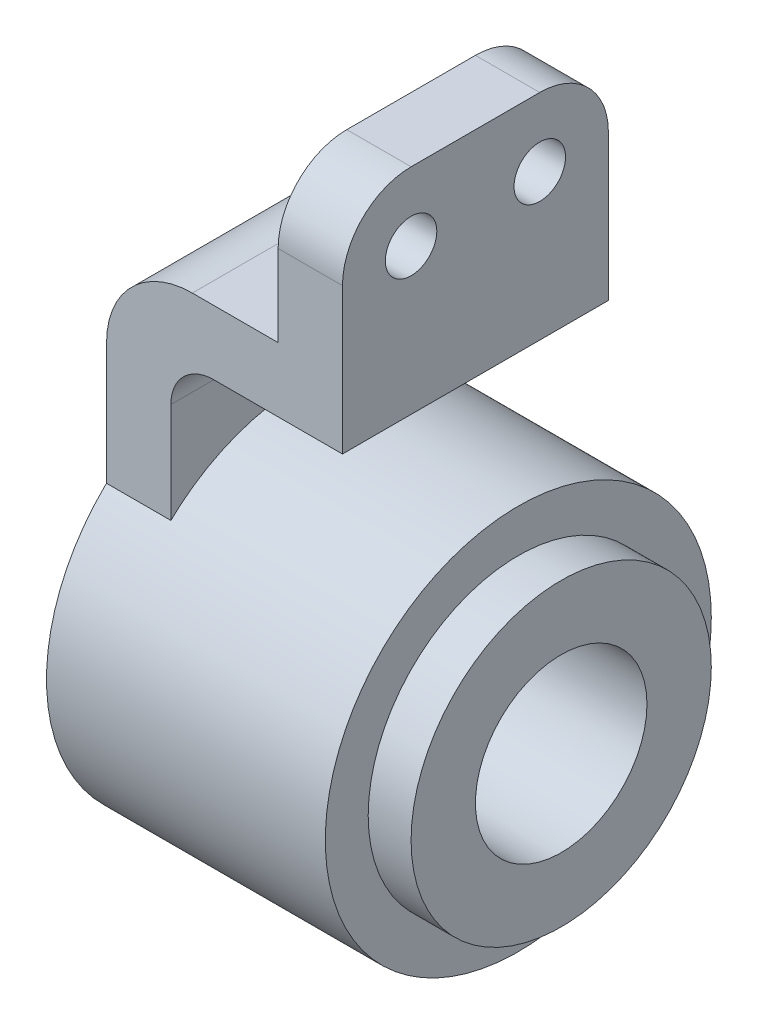
from build123d import *

# Parameters (mm, degrees)
BOSS_EXTRUDE1_DEPTH = 31
SKETCH7_W           = 20
SKETCH7_H           = 75
SKETCH9_W           = 20
SKETCH9_H           = 75
FILLET1_R           = 10
FILLET2_R           = 20
FILLET3_R           = 16
SKETCH11_W          = 6
SKETCH11_H          = 55
HOLE4_AT_2_COUNT    = 2
HOLE4_AT_2_PITCH    = 30


with BuildPart() as part:
    # Sketch1 → Revolve1 (revolve)
    with BuildSketch(Plane.XY, mode=Mode.PRIVATE) as revolve1_sk:
        Polygon((0, 0), (0, 45), (65, 45), (65, 35), (75, 35), (75, 0), align=None)
    revolve(revolve1_sk.sketch.rotate(Axis((75, 0, 0), (-1, 0, 0)), 90), axis=Axis((75, 0, 0), (-1, 0, 0)))

    # Sketch9 → Hole3 (revolve, cut)
    with BuildSketch(Plane(origin=(75, 0, 0), x_dir=(0, 0, -1), z_dir=(0, 1, 0))):
        with Locations((10, 37.5)):
            Rectangle(SKETCH9_W, SKETCH9_H)
    revolve(axis=Axis((-35, 0, 0), (1, 0, 0)), mode=Mode.SUBTRACT)


with BuildPart() as body_2:
    # Sketch4 → Boss-Extrude1 (new, symmetric)
    with BuildSketch(Plane.XY):
        Polygon((0, 0), (0, 81), (40, 81), (40, 116), (55, 116), (55, 66), (15, 66), (15, 0), align=None)
    extrude(amount=BOSS_EXTRUDE1_DEPTH, both=True)

    # Sketch7 → Hole2 (revolve, cut)
    with BuildSketch(Plane.ZX):
        with Locations((10, 37.5)):
            Rectangle(SKETCH7_W, SKETCH7_H)
    revolve(axis=Axis((110, 0, 0), (-1, 0, 0)), mode=Mode.SUBTRACT)

    # Fillet1
    fillet1_edges = [body_2.edges().sort_by_distance(p)[0] for p in [
        (15, 66, 0),
    ]]
    fillet(fillet1_edges, radius=FILLET1_R)

    # Fillet2
    fillet2_edges = [body_2.edges().sort_by_distance(p)[0] for p in [
        (0, 81, 0),
    ]]
    fillet(fillet2_edges, radius=FILLET2_R)

    # Fillet3
    fillet3_edges = [body_2.edges().sort_by_distance(p)[0] for p in [
        (47.5, 116, 31),
        (47.5, 116, -31),
    ]]
    fillet(fillet3_edges, radius=FILLET3_R)

    # Sketch11 → Hole4 (revolve, cut)
    with BuildSketch(Plane(origin=(55, 100, -15), x_dir=(0, 0, -1), z_dir=(0, 1, 0))):
        with Locations((3, 27.5)):
            Rectangle(SKETCH11_W, SKETCH11_H)
    hole4 = revolve(axis=Axis((-55, 100, -15), (1, 0, 0)), mode=Mode.SUBTRACT)

    # Hole4 at 2: Hole4 ×2
    with Locations(*[(0, 0, i * HOLE4_AT_2_PITCH) for i in range(1, HOLE4_AT_2_COUNT)]):
        add(hole4, mode=Mode.SUBTRACT)


solid = Compound([part.part, body_2.part])
